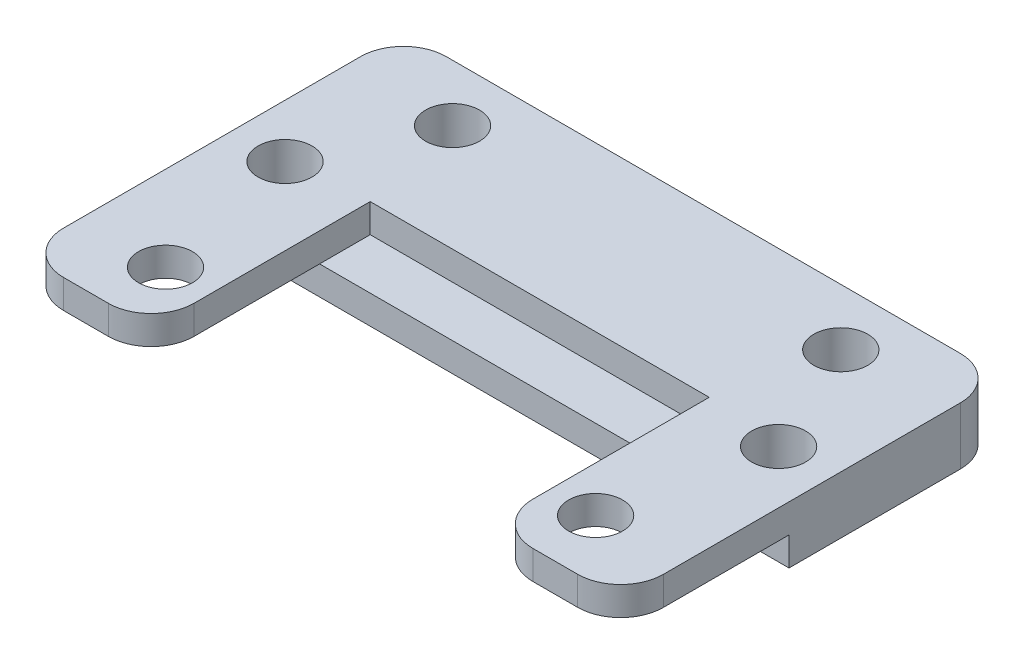
from build123d import *

# Parameters (mm, degrees)
SKETCH1_R           = 1.6
BOSS_EXTRUDE1_DEPTH = 3.4
SKETCH2_R           = 1.6
BOSS_EXTRUDE2_DEPTH = 1.7
SKETCH3_W           = 20.1
SKETCH3_H           = 3
CUT_EXTRUDE1_DEPTH  = 1.7


with BuildPart() as part:
    # Sketch1 → Boss-Extrude1 (new body)
    with BuildSketch(Plane(origin=(0, 80.955025863, 0), x_dir=(1, 0, 0), z_dir=(0, 1, 0))):
        with BuildLine():
            Line((86.165130669, -156.732155685), (116.645130669, -156.732155685))
            ThreePointArc((116.645130669, -156.732155685), (118.441181893, -157.47610446), (119.185130669, -159.272155685))
            Line((119.185130669, -159.272155685), (119.185130669, -169.432155685))
            Line((119.185130669, -169.432155685), (83.625130669, -169.432155685))
            Line((83.625130669, -169.432155685), (83.625130669, -159.272155685))
            ThreePointArc((83.625130669, -159.272155685), (84.369079444, -157.47610446), (86.165130669, -156.732155685))
        make_face()
        with Locations(Location((116.03690482, -166.898975693, 0), (0, 0, 270))):
            Circle(SKETCH1_R, mode=Mode.SUBTRACT)
        with Locations(Location((112.914749612, -160.090079663, 0), (0, 0, 270))):
            Circle(SKETCH1_R, mode=Mode.SUBTRACT)
        with Locations(Location((89.895511725, -160.090079663, 0), (0, 0, 270))):
            Circle(SKETCH1_R, mode=Mode.SUBTRACT)
        with Locations(Location((86.773356517, -166.898975693, 0), (0, 0, 270))):
            Circle(SKETCH1_R, mode=Mode.SUBTRACT)
    extrude(amount=BOSS_EXTRUDE1_DEPTH)

    # Sketch2 → Boss-Extrude2 (add)
    # profile 1 of 2: a face of its own
    with BuildSketch(Plane(origin=(0, 84.355025863, 0), x_dir=(1, 0, 0), z_dir=(0, 1, 0))):
        with BuildLine():
            Line((83.625130669, -169.432155685), (91.355130669, -169.432155685))
            Line((91.355130669, -169.432155685), (91.355130669, -176.877155685))
            ThreePointArc((91.355130669, -176.877155685), (90.611181893, -178.673206909), (88.815130669, -179.417155685))
            Line((88.815130669, -179.417155685), (86.165130669, -179.417155685))
            ThreePointArc((86.165130669, -179.417155685), (84.369079444, -178.673206909), (83.625130669, -176.877155685))
            Line((83.625130669, -176.877155685), (83.625130669, -169.432155685))
        make_face()
        with Locations(Location((88.655130669, -175.867155685, 0), (0, 0, 270))):
            Circle(SKETCH2_R, mode=Mode.SUBTRACT)
    # profile 2 of 2: a face of its own
    with BuildSketch(Plane(origin=(0, 84.355025863, 0), x_dir=(1, 0, 0), z_dir=(0, 1, 0))):
        with BuildLine():
            Line((119.185130669, -169.432155685), (111.455130669, -169.432155685))
            Line((111.455130669, -169.432155685), (111.455130669, -176.877155685))
            ThreePointArc((111.455130669, -176.877155685), (112.199079444, -178.673206909), (113.995130669, -179.417155685))
            Line((113.995130669, -179.417155685), (116.645130669, -179.417155685))
            ThreePointArc((116.645130669, -179.417155685), (118.441181893, -178.673206909), (119.185130669, -176.877155685))
            Line((119.185130669, -176.877155685), (119.185130669, -169.432155685))
        make_face()
        with Locations(Location((114.155130669, -175.867155685, 0), (0, 0, 270))):
            Circle(SKETCH2_R, mode=Mode.SUBTRACT)
    extrude(amount=-BOSS_EXTRUDE2_DEPTH)

    # Sketch3 → Cut-Extrude1 (cut)
    with BuildSketch(Plane(origin=(0, 84.355025863, 0), x_dir=(1, 0, 0), z_dir=(0, 1, 0))):
        with Locations((101.405130669, -167.932155685)):
            Rectangle(SKETCH3_W, SKETCH3_H)
    extrude(amount=-CUT_EXTRUDE1_DEPTH, mode=Mode.SUBTRACT)


solid = part.part
